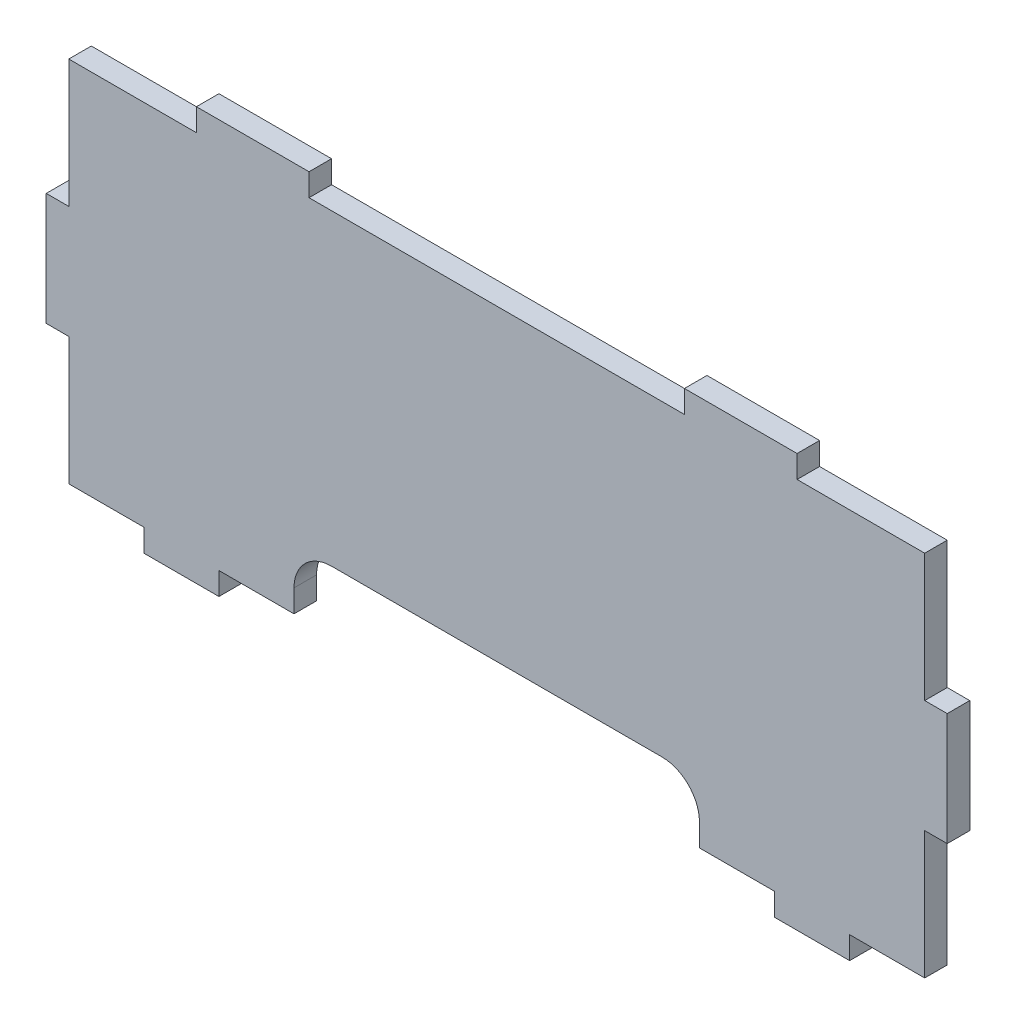
from build123d import *

# Parameters (mm, degrees)
BOSS_EXTRUDE1_DEPTH = 3


with BuildPart() as part:
    # Sketch1 → Boss-Extrude1 (new body)
    with BuildSketch(Plane.XY):
        with BuildLine():
            Line((-57, -28.5), (-57, -11.5))
            Line((-57, -11.5), (-60, -11.5))
            Line((-60, -11.5), (-60, 3.5))
            Line((-60, 3.5), (-57, 3.5))
            Line((-57, 3.5), (-57, 20.5))
            Line((-57, 20.5), (-40, 20.5))
            Line((-40, 20.5), (-40, 23.5))
            Line((-40, 23.5), (-25, 23.5))
            Line((-25, 23.5), (-25, 20.5))
            Line((-25, 20.5), (25, 20.5))
            Line((25, 20.5), (25, 23.5))
            Line((25, 23.5), (40, 23.5))
            Line((40, 23.5), (40, 20.5))
            Line((40, 20.5), (57, 20.5))
            Line((57, 20.5), (57, 3.5))
            Line((57, 3.5), (60, 3.5))
            Line((60, 3.5), (60, -11.5))
            Line((60, -11.5), (57, -11.5))
            Line((57, -11.5), (57, -28.5))
            Line((57, -28.5), (47, -28.5))
            Line((47, -28.5), (47, -31.5))
            Line((47, -31.5), (37, -31.5))
            Line((37, -31.5), (37, -28.5))
            Line((37, -28.5), (27, -28.5))
            Line((27, -28.5), (27, -25.5))
            ThreePointArc((27, -25.5), (25.535533906, -21.964466094), (22, -20.5))
            Line((22, -20.5), (-22, -20.5))
            ThreePointArc((-22, -20.5), (-25.535533906, -21.964466094), (-27, -25.5))
            Line((-27, -25.5), (-27, -28.5))
            Line((-27, -28.5), (-37, -28.5))
            Line((-37, -28.5), (-37, -31.5))
            Line((-37, -31.5), (-47, -31.5))
            Line((-47, -31.5), (-47, -28.5))
            Line((-47, -28.5), (-57, -28.5))
        make_face()
    extrude(amount=BOSS_EXTRUDE1_DEPTH)


solid = part.part
